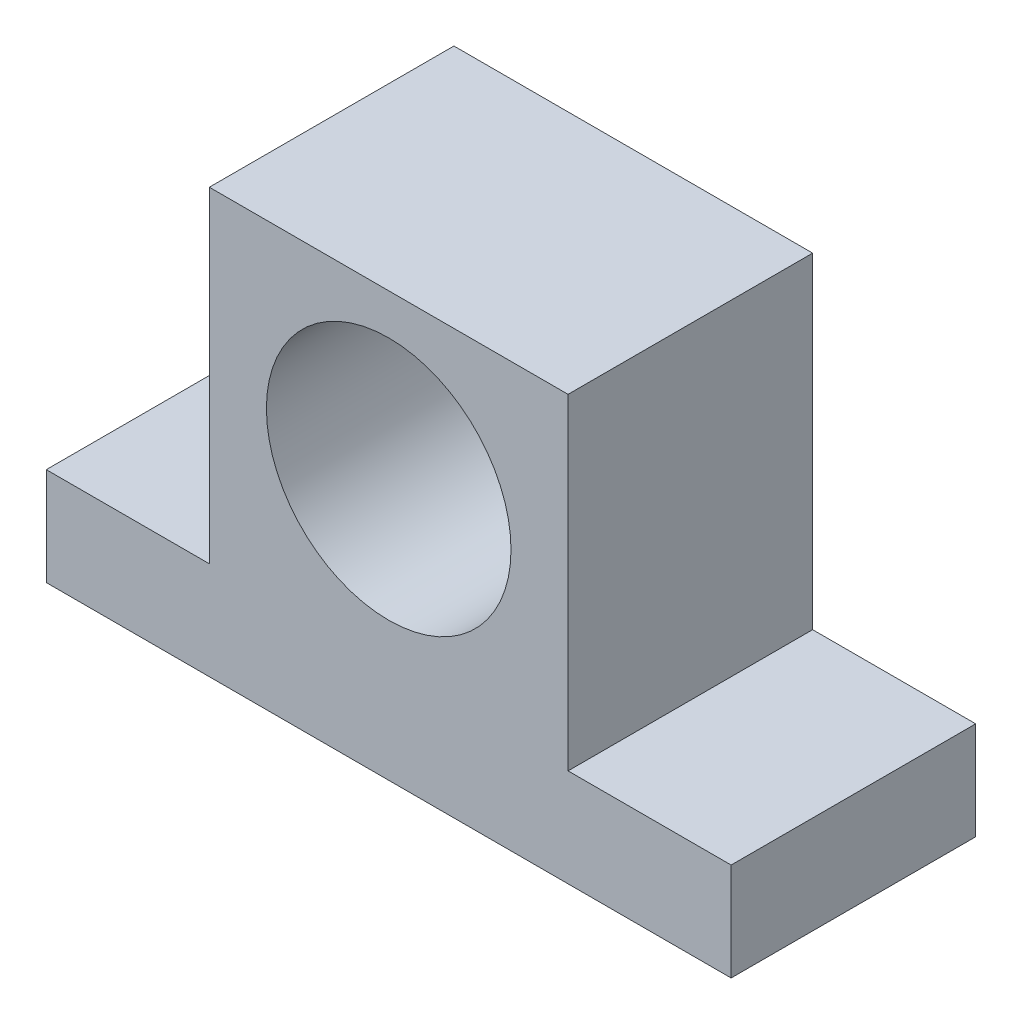
from build123d import *

# Parameters (mm, degrees)
SKETCH1_R           = 7.5
BOSS_EXTRUDE1_DEPTH = 15


with BuildPart() as part:
    # Sketch1 → Boss-Extrude1 (new body)
    with BuildSketch(Plane.XY):
        Polygon((11, -10), (21, -10), (21, -16), (-21, -16), (-21, -10), (-11, -10), (-11, 10), (11, 10), align=None)
        Circle(SKETCH1_R, mode=Mode.SUBTRACT)
    extrude(amount=BOSS_EXTRUDE1_DEPTH)


solid = part.part
